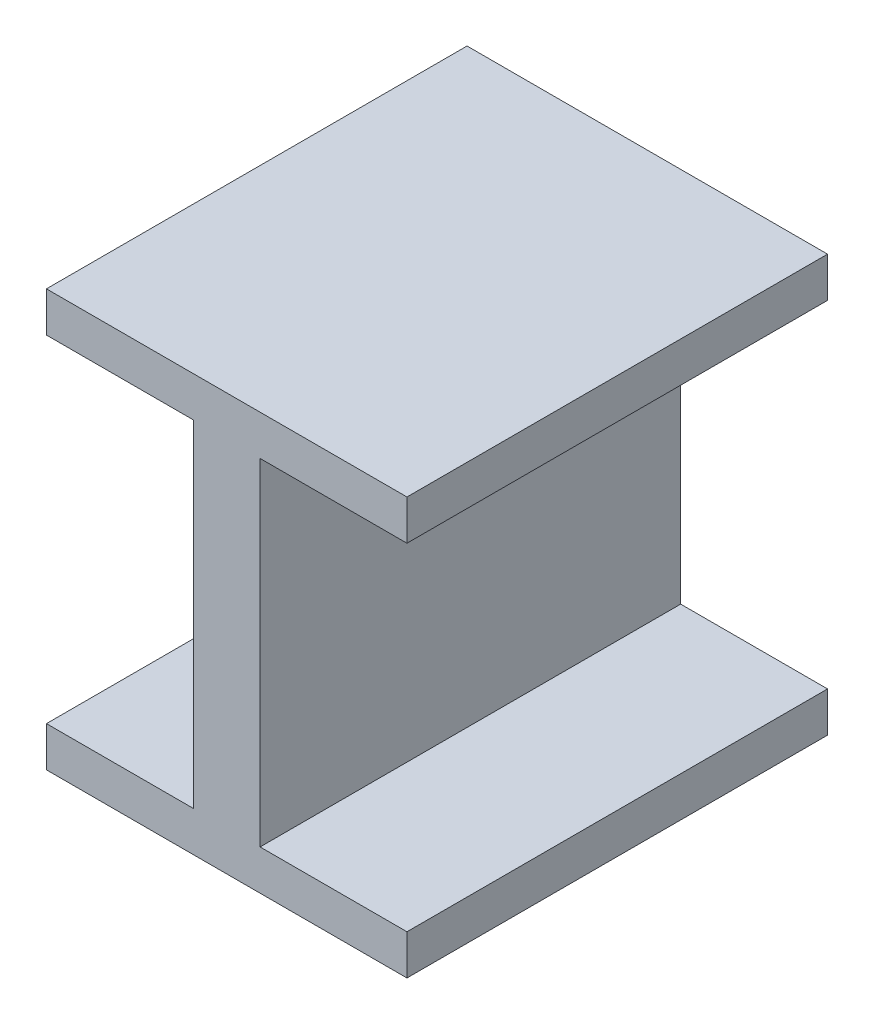
from build123d import *

# Parameters (mm, degrees)
SKETCH_1_W      = 54
SKETCH_1_H      = 63
EXTRUDE_1_DEPTH = 6
SKETCH_2_W      = 10
SKETCH_2_H      = 63
EXTRUDE_2_DEPTH = 50.4
SKETCH_3_W      = 54
SKETCH_3_H      = 63
EXTRUDE_3_DEPTH = 6


with BuildPart() as part:
    # 草图1 → 凸台-拉伸1 (new body)
    with BuildSketch(Plane(origin=(0, 0, 0), x_dir=(1, 0, 0), z_dir=(0, 1, 0))):
        Rectangle(SKETCH_1_W, SKETCH_1_H)
    extrude(amount=EXTRUDE_1_DEPTH)

    # 草图2 → 凸台-拉伸2 (add)
    with BuildSketch(Plane(origin=(0, 6, 0), x_dir=(1, 0, 0), z_dir=(0, 1, 0))):
        Rectangle(SKETCH_2_W, SKETCH_2_H)
    extrude(amount=EXTRUDE_2_DEPTH)

    # 草图3 → 凸台-拉伸3 (add)
    with BuildSketch(Plane(origin=(0, 56.4, 0), x_dir=(1, 0, 0), z_dir=(0, 1, 0))):
        Rectangle(SKETCH_3_W, SKETCH_3_H)
    extrude(amount=EXTRUDE_3_DEPTH)


solid = part.part
